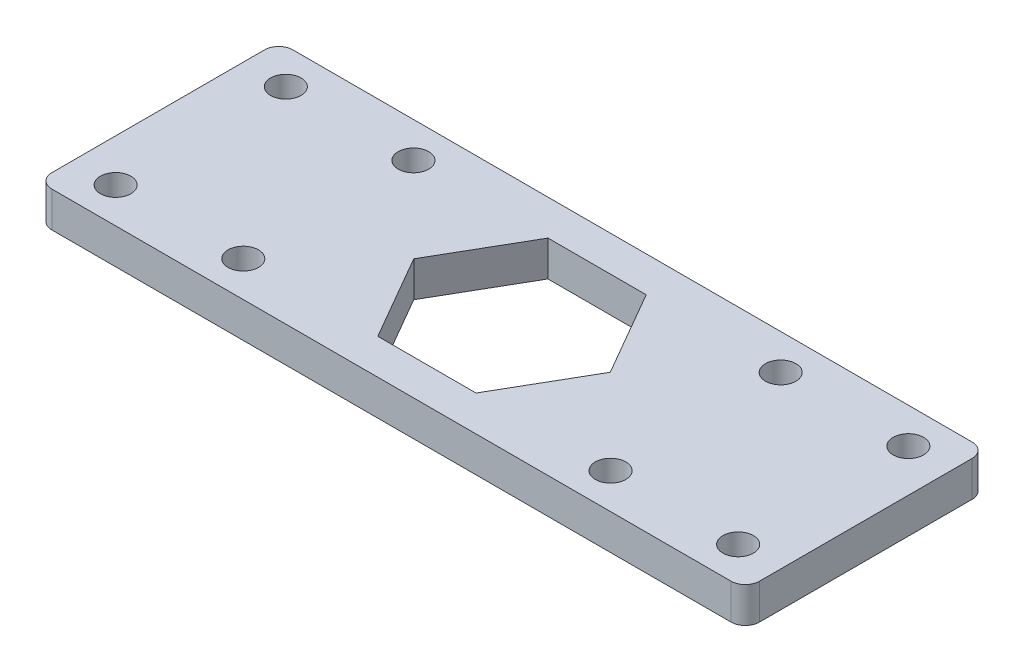
from build123d import *

# Parameters (mm, degrees)
SKETCH1_W           = 99.8
SKETCH1_H           = 34
BOSS_EXTRUDE1_DEPTH = 5
SKETCH2_R           = 2.15
CUT_EXTRUDE1_DEPTH  = 5
FILLET1_R           = 2


with BuildPart() as part:
    # Sketch1 → Boss-Extrude1 (new body)
    with BuildSketch(Plane(origin=(0, 0, 0), x_dir=(1, 0, 0), z_dir=(0, 1, 0))):
        Rectangle(SKETCH1_W, SKETCH1_H)
    extrude(amount=BOSS_EXTRUDE1_DEPTH)

    # Sketch2 → Cut-Extrude1 (cut)
    with BuildSketch(Plane(origin=(0, 5, 0), x_dir=(1, 0, 0), z_dir=(0, 1, 0))):
        with Locations(Location((-43.9, 12, 0), (0, 0, 270))):
            Circle(SKETCH2_R)
        with Locations(Location((-25.9, 12, 0), (0, 0, 270))):
            Circle(SKETCH2_R)
        with Locations(Location((-43.9, -12, 0), (0, 0, 270))):
            Circle(SKETCH2_R)
        with Locations(Location((-25.9, -12, 0), (0, 0, 270))):
            Circle(SKETCH2_R)
        with Locations(Location((25.9, -12, 0), (0, 0, 90))):
            Circle(SKETCH2_R)
        with Locations(Location((43.9, -12, 0), (0, 0, 90))):
            Circle(SKETCH2_R)
        with Locations(Location((25.9, 12, 0), (0, 0, 90))):
            Circle(SKETCH2_R)
        with Locations(Location((43.9, 12, 0), (0, 0, 90))):
            Circle(SKETCH2_R)
        Polygon((-13.856406461, 0), (-6.92820323, -12), (6.92820323, -12), (13.856406461, 0), (6.92820323, 12), (-6.92820323, 12), align=None)
    extrude(amount=-CUT_EXTRUDE1_DEPTH, mode=Mode.SUBTRACT)

    # Fillet1
    fillet1_edges = [part.edges().sort_by_distance(p)[0] for p in [
        (-49.9, 2.5, -17),
        (49.9, 2.5, -17),
        (49.9, 2.5, 17),
        (-49.9, 2.5, 17),
    ]]
    fillet(fillet1_edges, radius=FILLET1_R)


solid = part.part
